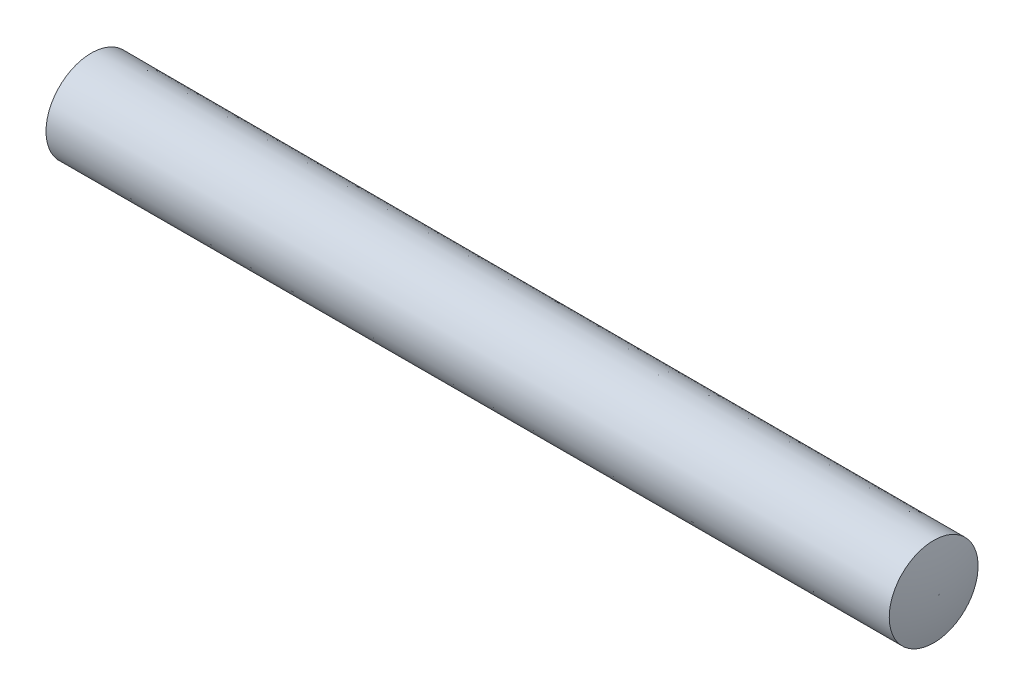
from build123d import *


with BuildPart() as part:
    # Sketch1 → Base-Revolve (revolve)
    with BuildSketch(Plane.XY, mode=Mode.PRIVATE) as base_revolve_sk:
        with BuildLine():
            Line((0, 0), (0, 0.011938))
            ThreePointArc((0, 0.011938), (0.037287212, 0.607519607), (0.148566531, 1.1938))
            Line((0.148566531, 1.1938), (22.373566531, 1.172038021))
            ThreePointArc((22.373566531, 1.172038021), (22.480728037, 0.596381919), (22.516628474, 0.011938))
            Line((22.516628474, 0.011938), (22.516628474, 0))
            Line((22.516628474, 0), (0, 0))
        make_face()
    revolve(base_revolve_sk.sketch.rotate(Axis((-5.588, 0, 0), (1, 0, 0)), 90), axis=Axis((-5.588, 0, 0), (1, 0, 0)))


solid = part.part
